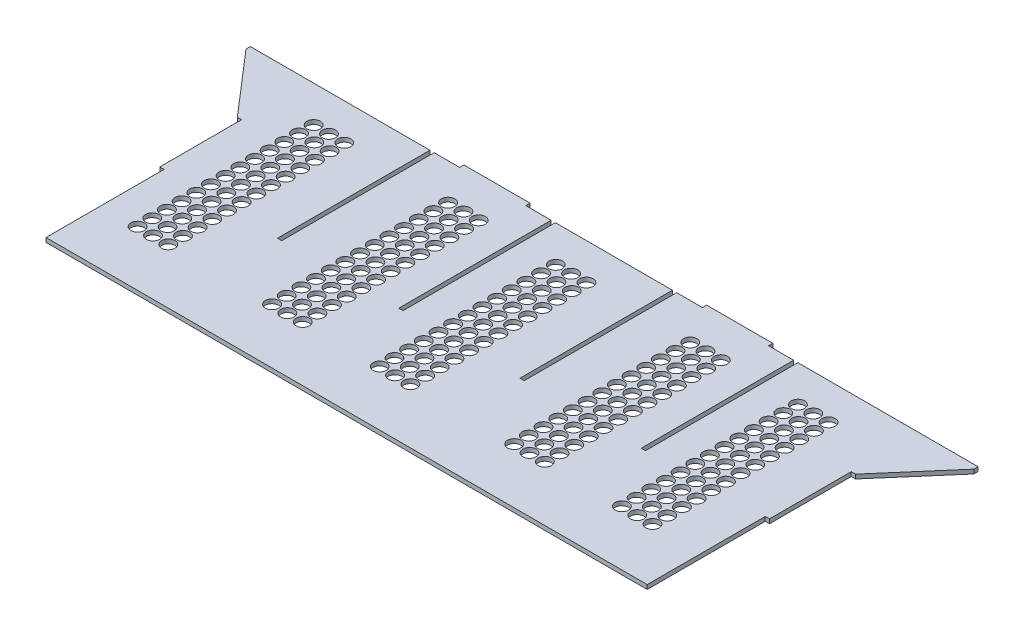
from build123d import *

# Parameters (mm, degrees)
SKETCH1_W                  = 457.2230066
SKETCH1_H                  = 3.175
BOSS_EXTRUDE1_DEPTH        = 200.6419914
SKETCH2_W                  = 3.175
SKETCH2_H                  = 114.3
CUT_EXTRUDE1_DEPTH         = 305.188278504
LPATTERN1_COUNT            = 4
LPATTERN1_PITCH            = 90.932
BOSS_EXTRUDE3_DEPTH        = 3.175
SKETCH5_W                  = 3.175
SKETCH5_H                  = 88.514
CUT_EXTRUDE2_DEPTH         = 3.175
SKETCH3_W                  = 49.658811606
SKETCH3_H                  = 3.175
BOSS_EXTRUDE4_DEPTH        = 3.18
SKETCH6_R                  = 5
CUT_EXTRUDE3_DEPTH         = 339.72456808
LPATTERN2_COUNT            = 13
LPATTERN2_PITCH            = 11
LPATTERN3_COUNT            = 3
LPATTERN3_PITCH            = 181.6
LPATTERN3_COPY_1_SKETCH_R  = 5
LPATTERN3_COPY_1_DEPTH     = 339.72456808
LPATTERN3_COPY_2_SKETCH_R  = 5
LPATTERN3_COPY_2_DEPTH     = 339.72456808
LPATTERN3_COPY_3_SKETCH_R  = 5
LPATTERN3_COPY_3_DEPTH     = 339.72456808
LPATTERN3_COPY_4_SKETCH_R  = 5
LPATTERN3_COPY_4_DEPTH     = 339.72456808
LPATTERN3_COPY_5_SKETCH_R  = 5
LPATTERN3_COPY_5_DEPTH     = 339.72456808
LPATTERN3_COPY_6_SKETCH_R  = 5
LPATTERN3_COPY_6_DEPTH     = 339.72456808
LPATTERN3_COPY_7_SKETCH_R  = 5
LPATTERN3_COPY_7_DEPTH     = 339.72456808
LPATTERN3_COPY_8_SKETCH_R  = 5
LPATTERN3_COPY_8_DEPTH     = 339.72456808
LPATTERN3_COPY_9_SKETCH_R  = 5
LPATTERN3_COPY_9_DEPTH     = 339.72456808
LPATTERN3_COPY_10_SKETCH_R = 5
LPATTERN3_COPY_10_DEPTH    = 339.72456808
LPATTERN3_COPY_11_SKETCH_R = 5
LPATTERN3_COPY_11_DEPTH    = 339.72456808
LPATTERN3_COPY_12_SKETCH_R = 5
LPATTERN3_COPY_12_DEPTH    = 339.72456808
LPATTERN3_COPY_13_SKETCH_R = 5
LPATTERN3_COPY_13_DEPTH    = 339.72456808
LPATTERN3_COPY_14_SKETCH_R = 5
LPATTERN3_COPY_14_DEPTH    = 339.72456808
LPATTERN3_COPY_15_SKETCH_R = 5
LPATTERN3_COPY_15_DEPTH    = 339.72456808
LPATTERN3_COPY_16_SKETCH_R = 5
LPATTERN3_COPY_16_DEPTH    = 339.72456808
LPATTERN3_COPY_17_SKETCH_R = 5
LPATTERN3_COPY_17_DEPTH    = 339.72456808
LPATTERN3_COPY_18_SKETCH_R = 5
LPATTERN3_COPY_18_DEPTH    = 339.72456808
LPATTERN3_COPY_19_SKETCH_R = 5
LPATTERN3_COPY_19_DEPTH    = 339.72456808
LPATTERN3_COPY_20_SKETCH_R = 5
LPATTERN3_COPY_20_DEPTH    = 339.72456808
LPATTERN3_COPY_21_SKETCH_R = 5
LPATTERN3_COPY_21_DEPTH    = 339.72456808
LPATTERN3_COPY_22_SKETCH_R = 5
LPATTERN3_COPY_22_DEPTH    = 339.72456808
LPATTERN3_COPY_23_SKETCH_R = 5
LPATTERN3_COPY_23_DEPTH    = 339.72456808
LPATTERN3_COPY_24_SKETCH_R = 5
LPATTERN3_COPY_24_DEPTH    = 339.72456808
SKETCH9_R                  = 5
CUT_EXTRUDE4_DEPTH         = 339.72456808
LPATTERN5_COUNT            = 13
LPATTERN5_PITCH            = 11
LPATTERN6_COUNT            = 2
LPATTERN6_PITCH            = 181.6
LPATTERN6_COPY_1_SKETCH_R  = 5
LPATTERN6_COPY_1_DEPTH     = 339.72456808
LPATTERN6_COPY_2_SKETCH_R  = 5
LPATTERN6_COPY_2_DEPTH     = 339.72456808
LPATTERN6_COPY_3_SKETCH_R  = 5
LPATTERN6_COPY_3_DEPTH     = 339.72456808
LPATTERN6_COPY_4_SKETCH_R  = 5
LPATTERN6_COPY_4_DEPTH     = 339.72456808
LPATTERN6_COPY_5_SKETCH_R  = 5
LPATTERN6_COPY_5_DEPTH     = 339.72456808
LPATTERN6_COPY_6_SKETCH_R  = 5
LPATTERN6_COPY_6_DEPTH     = 339.72456808
LPATTERN6_COPY_7_SKETCH_R  = 5
LPATTERN6_COPY_7_DEPTH     = 339.72456808
LPATTERN6_COPY_8_SKETCH_R  = 5
LPATTERN6_COPY_8_DEPTH     = 339.72456808
LPATTERN6_COPY_9_SKETCH_R  = 5
LPATTERN6_COPY_9_DEPTH     = 339.72456808
LPATTERN6_COPY_10_SKETCH_R = 5
LPATTERN6_COPY_10_DEPTH    = 339.72456808
LPATTERN6_COPY_11_SKETCH_R = 5
LPATTERN6_COPY_11_DEPTH    = 339.72456808
LPATTERN6_COPY_12_SKETCH_R = 5
LPATTERN6_COPY_12_DEPTH    = 339.72456808


with BuildPart() as part:
    # Sketch1 → Boss-Extrude1 (new body)
    with BuildSketch(Plane.XY):
        Rectangle(SKETCH1_W, SKETCH1_H)
    extrude(amount=BOSS_EXTRUDE1_DEPTH)

    # Sketch2 → Cut-Extrude1 (cut, through all)
    with BuildSketch(Plane(origin=(0, 1.5875, 0), x_dir=(1, 0, 0), z_dir=(0, 1, 0))):
        with Locations((136.2190033, -57.15)):
            Rectangle(SKETCH2_W, SKETCH2_H)
    cut_extrude1 = extrude(amount=-CUT_EXTRUDE1_DEPTH, mode=Mode.SUBTRACT)

    # LPattern1: Cut-Extrude1 ×4
    with Locations(*[(-i * LPATTERN1_PITCH, 0, 0) for i in range(1, LPATTERN1_COUNT)]):
        add(cut_extrude1, mode=Mode.SUBTRACT)

    # Sketch4 → Boss-Extrude3 (add)
    with BuildSketch(Plane.XZ.offset(1.5875)):
        Polygon((-228.6115033, 0), (-272.8865033, 0), (-272.8865033, 3.175), (-231.7865033, 50.8), (-228.6115033, 50.8), align=None)
    boss_extrude3 = extrude(amount=-BOSS_EXTRUDE3_DEPTH)

    # Mirror1: Boss-Extrude3 across plane
    add(boss_extrude3.mirror(Plane(origin=(0, 0, 0), x_dir=(0, 0, 1), z_dir=(1, 0, 0))))

    # Sketch5 → Cut-Extrude2 (cut)
    with BuildSketch(Plane.XZ.offset(1.5875)):
        with Locations((-227.0240033, 156.3849914)):
            Rectangle(SKETCH5_W, SKETCH5_H)
    cut_extrude2 = extrude(amount=-CUT_EXTRUDE2_DEPTH, mode=Mode.SUBTRACT)

    # Mirror2: Cut-Extrude2 across plane
    add(cut_extrude2.mirror(Plane(origin=(0, 0, 0), x_dir=(0, 0, 1), z_dir=(1, 0, 0))), mode=Mode.SUBTRACT)

    # Sketch3 → Boss-Extrude4 (add)
    with BuildSketch(Plane(origin=(0, 0, 0), x_dir=(-1, 0, 0), z_dir=(0, 0, -1))):
        with Locations((-91.020094169, 0)):
            Rectangle(SKETCH3_W, SKETCH3_H)
        with Locations((91.020094169, 0)):
            Rectangle(SKETCH3_W, SKETCH3_H)
    extrude(amount=BOSS_EXTRUDE4_DEPTH)

    # Sketch6 → Cut-Extrude3 (cut, through all)
    with BuildSketch(Plane.XZ.offset(1.5875)):
        with Locations(Location((-175.1185, 159.256662939, 0), (0, 0, 270))):
            Circle(SKETCH6_R)
        with Locations(Location((-186.6185, 159.256662939, 0), (0, 0, 270))):
            Circle(SKETCH6_R)
        with Locations(Location((-198.1185, 159.256662939, 0), (0, 0, 270))):
            Circle(SKETCH6_R)
    cut_extrude3 = extrude(amount=-CUT_EXTRUDE3_DEPTH, mode=Mode.SUBTRACT)

    # LPattern2: Cut-Extrude3 ×13
    with Locations(*[(0, 0, -i * LPATTERN2_PITCH) for i in range(1, LPATTERN2_COUNT)]):
        add(cut_extrude3, mode=Mode.SUBTRACT)

    # LPattern3: Cut-Extrude3 ×3
    with Locations(*[(i * LPATTERN3_PITCH, 0, 0) for i in range(1, LPATTERN3_COUNT)]):
        add(cut_extrude3, mode=Mode.SUBTRACT)

    # LPattern3 copy 1 sketch → LPattern3 copy 1 (cut, through all)
    with BuildSketch(Plane(origin=(181.6, -1.5875, -11), x_dir=(1, 0, 0), z_dir=(0, -1, 0))):
        with Locations(Location((-175.1185, 159.256662939, 0), (0, 0, 270))):
            Circle(LPATTERN3_COPY_1_SKETCH_R)
        with Locations(Location((-186.6185, 159.256662939, 0), (0, 0, 270))):
            Circle(LPATTERN3_COPY_1_SKETCH_R)
        with Locations(Location((-198.1185, 159.256662939, 0), (0, 0, 270))):
            Circle(LPATTERN3_COPY_1_SKETCH_R)
    extrude(amount=-LPATTERN3_COPY_1_DEPTH, mode=Mode.SUBTRACT)

    # LPattern3 copy 2 sketch → LPattern3 copy 2 (cut, through all)
    with BuildSketch(Plane(origin=(363.2, -1.5875, -11), x_dir=(1, 0, 0), z_dir=(0, -1, 0))):
        with Locations(Location((-175.1185, 159.256662939, 0), (0, 0, 270))):
            Circle(LPATTERN3_COPY_2_SKETCH_R)
        with Locations(Location((-186.6185, 159.256662939, 0), (0, 0, 270))):
            Circle(LPATTERN3_COPY_2_SKETCH_R)
        with Locations(Location((-198.1185, 159.256662939, 0), (0, 0, 270))):
            Circle(LPATTERN3_COPY_2_SKETCH_R)
    extrude(amount=-LPATTERN3_COPY_2_DEPTH, mode=Mode.SUBTRACT)

    # LPattern3 copy 3 sketch → LPattern3 copy 3 (cut, through all)
    with BuildSketch(Plane(origin=(181.6, -1.5875, -22), x_dir=(1, 0, 0), z_dir=(0, -1, 0))):
        with Locations(Location((-175.1185, 159.256662939, 0), (0, 0, 270))):
            Circle(LPATTERN3_COPY_3_SKETCH_R)
        with Locations(Location((-186.6185, 159.256662939, 0), (0, 0, 270))):
            Circle(LPATTERN3_COPY_3_SKETCH_R)
        with Locations(Location((-198.1185, 159.256662939, 0), (0, 0, 270))):
            Circle(LPATTERN3_COPY_3_SKETCH_R)
    extrude(amount=-LPATTERN3_COPY_3_DEPTH, mode=Mode.SUBTRACT)

    # LPattern3 copy 4 sketch → LPattern3 copy 4 (cut, through all)
    with BuildSketch(Plane(origin=(363.2, -1.5875, -22), x_dir=(1, 0, 0), z_dir=(0, -1, 0))):
        with Locations(Location((-175.1185, 159.256662939, 0), (0, 0, 270))):
            Circle(LPATTERN3_COPY_4_SKETCH_R)
        with Locations(Location((-186.6185, 159.256662939, 0), (0, 0, 270))):
            Circle(LPATTERN3_COPY_4_SKETCH_R)
        with Locations(Location((-198.1185, 159.256662939, 0), (0, 0, 270))):
            Circle(LPATTERN3_COPY_4_SKETCH_R)
    extrude(amount=-LPATTERN3_COPY_4_DEPTH, mode=Mode.SUBTRACT)

    # LPattern3 copy 5 sketch → LPattern3 copy 5 (cut, through all)
    with BuildSketch(Plane(origin=(181.6, -1.5875, -33), x_dir=(1, 0, 0), z_dir=(0, -1, 0))):
        with Locations(Location((-175.1185, 159.256662939, 0), (0, 0, 270))):
            Circle(LPATTERN3_COPY_5_SKETCH_R)
        with Locations(Location((-186.6185, 159.256662939, 0), (0, 0, 270))):
            Circle(LPATTERN3_COPY_5_SKETCH_R)
        with Locations(Location((-198.1185, 159.256662939, 0), (0, 0, 270))):
            Circle(LPATTERN3_COPY_5_SKETCH_R)
    extrude(amount=-LPATTERN3_COPY_5_DEPTH, mode=Mode.SUBTRACT)

    # LPattern3 copy 6 sketch → LPattern3 copy 6 (cut, through all)
    with BuildSketch(Plane(origin=(363.2, -1.5875, -33), x_dir=(1, 0, 0), z_dir=(0, -1, 0))):
        with Locations(Location((-175.1185, 159.256662939, 0), (0, 0, 270))):
            Circle(LPATTERN3_COPY_6_SKETCH_R)
        with Locations(Location((-186.6185, 159.256662939, 0), (0, 0, 270))):
            Circle(LPATTERN3_COPY_6_SKETCH_R)
        with Locations(Location((-198.1185, 159.256662939, 0), (0, 0, 270))):
            Circle(LPATTERN3_COPY_6_SKETCH_R)
    extrude(amount=-LPATTERN3_COPY_6_DEPTH, mode=Mode.SUBTRACT)

    # LPattern3 copy 7 sketch → LPattern3 copy 7 (cut, through all)
    with BuildSketch(Plane(origin=(181.6, -1.5875, -44), x_dir=(1, 0, 0), z_dir=(0, -1, 0))):
        with Locations(Location((-175.1185, 159.256662939, 0), (0, 0, 270))):
            Circle(LPATTERN3_COPY_7_SKETCH_R)
        with Locations(Location((-186.6185, 159.256662939, 0), (0, 0, 270))):
            Circle(LPATTERN3_COPY_7_SKETCH_R)
        with Locations(Location((-198.1185, 159.256662939, 0), (0, 0, 270))):
            Circle(LPATTERN3_COPY_7_SKETCH_R)
    extrude(amount=-LPATTERN3_COPY_7_DEPTH, mode=Mode.SUBTRACT)

    # LPattern3 copy 8 sketch → LPattern3 copy 8 (cut, through all)
    with BuildSketch(Plane(origin=(363.2, -1.5875, -44), x_dir=(1, 0, 0), z_dir=(0, -1, 0))):
        with Locations(Location((-175.1185, 159.256662939, 0), (0, 0, 270))):
            Circle(LPATTERN3_COPY_8_SKETCH_R)
        with Locations(Location((-186.6185, 159.256662939, 0), (0, 0, 270))):
            Circle(LPATTERN3_COPY_8_SKETCH_R)
        with Locations(Location((-198.1185, 159.256662939, 0), (0, 0, 270))):
            Circle(LPATTERN3_COPY_8_SKETCH_R)
    extrude(amount=-LPATTERN3_COPY_8_DEPTH, mode=Mode.SUBTRACT)

    # LPattern3 copy 9 sketch → LPattern3 copy 9 (cut, through all)
    with BuildSketch(Plane(origin=(181.6, -1.5875, -55), x_dir=(1, 0, 0), z_dir=(0, -1, 0))):
        with Locations(Location((-175.1185, 159.256662939, 0), (0, 0, 270))):
            Circle(LPATTERN3_COPY_9_SKETCH_R)
        with Locations(Location((-186.6185, 159.256662939, 0), (0, 0, 270))):
            Circle(LPATTERN3_COPY_9_SKETCH_R)
        with Locations(Location((-198.1185, 159.256662939, 0), (0, 0, 270))):
            Circle(LPATTERN3_COPY_9_SKETCH_R)
    extrude(amount=-LPATTERN3_COPY_9_DEPTH, mode=Mode.SUBTRACT)

    # LPattern3 copy 10 sketch → LPattern3 copy 10 (cut, through all)
    with BuildSketch(Plane(origin=(363.2, -1.5875, -55), x_dir=(1, 0, 0), z_dir=(0, -1, 0))):
        with Locations(Location((-175.1185, 159.256662939, 0), (0, 0, 270))):
            Circle(LPATTERN3_COPY_10_SKETCH_R)
        with Locations(Location((-186.6185, 159.256662939, 0), (0, 0, 270))):
            Circle(LPATTERN3_COPY_10_SKETCH_R)
        with Locations(Location((-198.1185, 159.256662939, 0), (0, 0, 270))):
            Circle(LPATTERN3_COPY_10_SKETCH_R)
    extrude(amount=-LPATTERN3_COPY_10_DEPTH, mode=Mode.SUBTRACT)

    # LPattern3 copy 11 sketch → LPattern3 copy 11 (cut, through all)
    with BuildSketch(Plane(origin=(181.6, -1.5875, -66), x_dir=(1, 0, 0), z_dir=(0, -1, 0))):
        with Locations(Location((-175.1185, 159.256662939, 0), (0, 0, 270))):
            Circle(LPATTERN3_COPY_11_SKETCH_R)
        with Locations(Location((-186.6185, 159.256662939, 0), (0, 0, 270))):
            Circle(LPATTERN3_COPY_11_SKETCH_R)
        with Locations(Location((-198.1185, 159.256662939, 0), (0, 0, 270))):
            Circle(LPATTERN3_COPY_11_SKETCH_R)
    extrude(amount=-LPATTERN3_COPY_11_DEPTH, mode=Mode.SUBTRACT)

    # LPattern3 copy 12 sketch → LPattern3 copy 12 (cut, through all)
    with BuildSketch(Plane(origin=(363.2, -1.5875, -66), x_dir=(1, 0, 0), z_dir=(0, -1, 0))):
        with Locations(Location((-175.1185, 159.256662939, 0), (0, 0, 270))):
            Circle(LPATTERN3_COPY_12_SKETCH_R)
        with Locations(Location((-186.6185, 159.256662939, 0), (0, 0, 270))):
            Circle(LPATTERN3_COPY_12_SKETCH_R)
        with Locations(Location((-198.1185, 159.256662939, 0), (0, 0, 270))):
            Circle(LPATTERN3_COPY_12_SKETCH_R)
    extrude(amount=-LPATTERN3_COPY_12_DEPTH, mode=Mode.SUBTRACT)

    # LPattern3 copy 13 sketch → LPattern3 copy 13 (cut, through all)
    with BuildSketch(Plane(origin=(181.6, -1.5875, -77), x_dir=(1, 0, 0), z_dir=(0, -1, 0))):
        with Locations(Location((-175.1185, 159.256662939, 0), (0, 0, 270))):
            Circle(LPATTERN3_COPY_13_SKETCH_R)
        with Locations(Location((-186.6185, 159.256662939, 0), (0, 0, 270))):
            Circle(LPATTERN3_COPY_13_SKETCH_R)
        with Locations(Location((-198.1185, 159.256662939, 0), (0, 0, 270))):
            Circle(LPATTERN3_COPY_13_SKETCH_R)
    extrude(amount=-LPATTERN3_COPY_13_DEPTH, mode=Mode.SUBTRACT)

    # LPattern3 copy 14 sketch → LPattern3 copy 14 (cut, through all)
    with BuildSketch(Plane(origin=(363.2, -1.5875, -77), x_dir=(1, 0, 0), z_dir=(0, -1, 0))):
        with Locations(Location((-175.1185, 159.256662939, 0), (0, 0, 270))):
            Circle(LPATTERN3_COPY_14_SKETCH_R)
        with Locations(Location((-186.6185, 159.256662939, 0), (0, 0, 270))):
            Circle(LPATTERN3_COPY_14_SKETCH_R)
        with Locations(Location((-198.1185, 159.256662939, 0), (0, 0, 270))):
            Circle(LPATTERN3_COPY_14_SKETCH_R)
    extrude(amount=-LPATTERN3_COPY_14_DEPTH, mode=Mode.SUBTRACT)

    # LPattern3 copy 15 sketch → LPattern3 copy 15 (cut, through all)
    with BuildSketch(Plane(origin=(181.6, -1.5875, -88), x_dir=(1, 0, 0), z_dir=(0, -1, 0))):
        with Locations(Location((-175.1185, 159.256662939, 0), (0, 0, 270))):
            Circle(LPATTERN3_COPY_15_SKETCH_R)
        with Locations(Location((-186.6185, 159.256662939, 0), (0, 0, 270))):
            Circle(LPATTERN3_COPY_15_SKETCH_R)
        with Locations(Location((-198.1185, 159.256662939, 0), (0, 0, 270))):
            Circle(LPATTERN3_COPY_15_SKETCH_R)
    extrude(amount=-LPATTERN3_COPY_15_DEPTH, mode=Mode.SUBTRACT)

    # LPattern3 copy 16 sketch → LPattern3 copy 16 (cut, through all)
    with BuildSketch(Plane(origin=(363.2, -1.5875, -88), x_dir=(1, 0, 0), z_dir=(0, -1, 0))):
        with Locations(Location((-175.1185, 159.256662939, 0), (0, 0, 270))):
            Circle(LPATTERN3_COPY_16_SKETCH_R)
        with Locations(Location((-186.6185, 159.256662939, 0), (0, 0, 270))):
            Circle(LPATTERN3_COPY_16_SKETCH_R)
        with Locations(Location((-198.1185, 159.256662939, 0), (0, 0, 270))):
            Circle(LPATTERN3_COPY_16_SKETCH_R)
    extrude(amount=-LPATTERN3_COPY_16_DEPTH, mode=Mode.SUBTRACT)

    # LPattern3 copy 17 sketch → LPattern3 copy 17 (cut, through all)
    with BuildSketch(Plane(origin=(181.6, -1.5875, -99), x_dir=(1, 0, 0), z_dir=(0, -1, 0))):
        with Locations(Location((-175.1185, 159.256662939, 0), (0, 0, 270))):
            Circle(LPATTERN3_COPY_17_SKETCH_R)
        with Locations(Location((-186.6185, 159.256662939, 0), (0, 0, 270))):
            Circle(LPATTERN3_COPY_17_SKETCH_R)
        with Locations(Location((-198.1185, 159.256662939, 0), (0, 0, 270))):
            Circle(LPATTERN3_COPY_17_SKETCH_R)
    extrude(amount=-LPATTERN3_COPY_17_DEPTH, mode=Mode.SUBTRACT)

    # LPattern3 copy 18 sketch → LPattern3 copy 18 (cut, through all)
    with BuildSketch(Plane(origin=(363.2, -1.5875, -99), x_dir=(1, 0, 0), z_dir=(0, -1, 0))):
        with Locations(Location((-175.1185, 159.256662939, 0), (0, 0, 270))):
            Circle(LPATTERN3_COPY_18_SKETCH_R)
        with Locations(Location((-186.6185, 159.256662939, 0), (0, 0, 270))):
            Circle(LPATTERN3_COPY_18_SKETCH_R)
        with Locations(Location((-198.1185, 159.256662939, 0), (0, 0, 270))):
            Circle(LPATTERN3_COPY_18_SKETCH_R)
    extrude(amount=-LPATTERN3_COPY_18_DEPTH, mode=Mode.SUBTRACT)

    # LPattern3 copy 19 sketch → LPattern3 copy 19 (cut, through all)
    with BuildSketch(Plane(origin=(181.6, -1.5875, -110), x_dir=(1, 0, 0), z_dir=(0, -1, 0))):
        with Locations(Location((-175.1185, 159.256662939, 0), (0, 0, 270))):
            Circle(LPATTERN3_COPY_19_SKETCH_R)
        with Locations(Location((-186.6185, 159.256662939, 0), (0, 0, 270))):
            Circle(LPATTERN3_COPY_19_SKETCH_R)
        with Locations(Location((-198.1185, 159.256662939, 0), (0, 0, 270))):
            Circle(LPATTERN3_COPY_19_SKETCH_R)
    extrude(amount=-LPATTERN3_COPY_19_DEPTH, mode=Mode.SUBTRACT)

    # LPattern3 copy 20 sketch → LPattern3 copy 20 (cut, through all)
    with BuildSketch(Plane(origin=(363.2, -1.5875, -110), x_dir=(1, 0, 0), z_dir=(0, -1, 0))):
        with Locations(Location((-175.1185, 159.256662939, 0), (0, 0, 270))):
            Circle(LPATTERN3_COPY_20_SKETCH_R)
        with Locations(Location((-186.6185, 159.256662939, 0), (0, 0, 270))):
            Circle(LPATTERN3_COPY_20_SKETCH_R)
        with Locations(Location((-198.1185, 159.256662939, 0), (0, 0, 270))):
            Circle(LPATTERN3_COPY_20_SKETCH_R)
    extrude(amount=-LPATTERN3_COPY_20_DEPTH, mode=Mode.SUBTRACT)

    # LPattern3 copy 21 sketch → LPattern3 copy 21 (cut, through all)
    with BuildSketch(Plane(origin=(181.6, -1.5875, -121), x_dir=(1, 0, 0), z_dir=(0, -1, 0))):
        with Locations(Location((-175.1185, 159.256662939, 0), (0, 0, 270))):
            Circle(LPATTERN3_COPY_21_SKETCH_R)
        with Locations(Location((-186.6185, 159.256662939, 0), (0, 0, 270))):
            Circle(LPATTERN3_COPY_21_SKETCH_R)
        with Locations(Location((-198.1185, 159.256662939, 0), (0, 0, 270))):
            Circle(LPATTERN3_COPY_21_SKETCH_R)
    extrude(amount=-LPATTERN3_COPY_21_DEPTH, mode=Mode.SUBTRACT)

    # LPattern3 copy 22 sketch → LPattern3 copy 22 (cut, through all)
    with BuildSketch(Plane(origin=(363.2, -1.5875, -121), x_dir=(1, 0, 0), z_dir=(0, -1, 0))):
        with Locations(Location((-175.1185, 159.256662939, 0), (0, 0, 270))):
            Circle(LPATTERN3_COPY_22_SKETCH_R)
        with Locations(Location((-186.6185, 159.256662939, 0), (0, 0, 270))):
            Circle(LPATTERN3_COPY_22_SKETCH_R)
        with Locations(Location((-198.1185, 159.256662939, 0), (0, 0, 270))):
            Circle(LPATTERN3_COPY_22_SKETCH_R)
    extrude(amount=-LPATTERN3_COPY_22_DEPTH, mode=Mode.SUBTRACT)

    # LPattern3 copy 23 sketch → LPattern3 copy 23 (cut, through all)
    with BuildSketch(Plane(origin=(181.6, -1.5875, -132), x_dir=(1, 0, 0), z_dir=(0, -1, 0))):
        with Locations(Location((-175.1185, 159.256662939, 0), (0, 0, 270))):
            Circle(LPATTERN3_COPY_23_SKETCH_R)
        with Locations(Location((-186.6185, 159.256662939, 0), (0, 0, 270))):
            Circle(LPATTERN3_COPY_23_SKETCH_R)
        with Locations(Location((-198.1185, 159.256662939, 0), (0, 0, 270))):
            Circle(LPATTERN3_COPY_23_SKETCH_R)
    extrude(amount=-LPATTERN3_COPY_23_DEPTH, mode=Mode.SUBTRACT)

    # LPattern3 copy 24 sketch → LPattern3 copy 24 (cut, through all)
    with BuildSketch(Plane(origin=(363.2, -1.5875, -132), x_dir=(1, 0, 0), z_dir=(0, -1, 0))):
        with Locations(Location((-175.1185, 159.256662939, 0), (0, 0, 270))):
            Circle(LPATTERN3_COPY_24_SKETCH_R)
        with Locations(Location((-186.6185, 159.256662939, 0), (0, 0, 270))):
            Circle(LPATTERN3_COPY_24_SKETCH_R)
        with Locations(Location((-198.1185, 159.256662939, 0), (0, 0, 270))):
            Circle(LPATTERN3_COPY_24_SKETCH_R)
    extrude(amount=-LPATTERN3_COPY_24_DEPTH, mode=Mode.SUBTRACT)

    # Sketch9 → Cut-Extrude4 (cut, through all)
    with BuildSketch(Plane.XZ.offset(1.5875)):
        with Locations(Location((-74.3095, 159.256662939, 0), (0, 0, 270))):
            Circle(SKETCH9_R)
        with Locations(Location((-85.8095, 159.256662939, 0), (0, 0, 270))):
            Circle(SKETCH9_R)
        with Locations(Location((-97.3095, 159.256662939, 0), (0, 0, 270))):
            Circle(SKETCH9_R)
    cut_extrude4 = extrude(amount=-CUT_EXTRUDE4_DEPTH, mode=Mode.SUBTRACT)

    # LPattern5: Cut-Extrude4 ×13
    with Locations(*[(0, 0, -i * LPATTERN5_PITCH) for i in range(1, LPATTERN5_COUNT)]):
        add(cut_extrude4, mode=Mode.SUBTRACT)

    # LPattern6: Cut-Extrude4 ×2
    with Locations(*[(i * LPATTERN6_PITCH, 0, 0) for i in range(1, LPATTERN6_COUNT)]):
        add(cut_extrude4, mode=Mode.SUBTRACT)

    # LPattern6 copy 1 sketch → LPattern6 copy 1 (cut, through all)
    with BuildSketch(Plane(origin=(181.6, -1.5875, -11), x_dir=(1, 0, 0), z_dir=(0, -1, 0))):
        with Locations(Location((-74.3095, 159.256662939, 0), (0, 0, 270))):
            Circle(LPATTERN6_COPY_1_SKETCH_R)
        with Locations(Location((-85.8095, 159.256662939, 0), (0, 0, 270))):
            Circle(LPATTERN6_COPY_1_SKETCH_R)
        with Locations(Location((-97.3095, 159.256662939, 0), (0, 0, 270))):
            Circle(LPATTERN6_COPY_1_SKETCH_R)
    extrude(amount=-LPATTERN6_COPY_1_DEPTH, mode=Mode.SUBTRACT)

    # LPattern6 copy 2 sketch → LPattern6 copy 2 (cut, through all)
    with BuildSketch(Plane(origin=(181.6, -1.5875, -22), x_dir=(1, 0, 0), z_dir=(0, -1, 0))):
        with Locations(Location((-74.3095, 159.256662939, 0), (0, 0, 270))):
            Circle(LPATTERN6_COPY_2_SKETCH_R)
        with Locations(Location((-85.8095, 159.256662939, 0), (0, 0, 270))):
            Circle(LPATTERN6_COPY_2_SKETCH_R)
        with Locations(Location((-97.3095, 159.256662939, 0), (0, 0, 270))):
            Circle(LPATTERN6_COPY_2_SKETCH_R)
    extrude(amount=-LPATTERN6_COPY_2_DEPTH, mode=Mode.SUBTRACT)

    # LPattern6 copy 3 sketch → LPattern6 copy 3 (cut, through all)
    with BuildSketch(Plane(origin=(181.6, -1.5875, -33), x_dir=(1, 0, 0), z_dir=(0, -1, 0))):
        with Locations(Location((-74.3095, 159.256662939, 0), (0, 0, 270))):
            Circle(LPATTERN6_COPY_3_SKETCH_R)
        with Locations(Location((-85.8095, 159.256662939, 0), (0, 0, 270))):
            Circle(LPATTERN6_COPY_3_SKETCH_R)
        with Locations(Location((-97.3095, 159.256662939, 0), (0, 0, 270))):
            Circle(LPATTERN6_COPY_3_SKETCH_R)
    extrude(amount=-LPATTERN6_COPY_3_DEPTH, mode=Mode.SUBTRACT)

    # LPattern6 copy 4 sketch → LPattern6 copy 4 (cut, through all)
    with BuildSketch(Plane(origin=(181.6, -1.5875, -44), x_dir=(1, 0, 0), z_dir=(0, -1, 0))):
        with Locations(Location((-74.3095, 159.256662939, 0), (0, 0, 270))):
            Circle(LPATTERN6_COPY_4_SKETCH_R)
        with Locations(Location((-85.8095, 159.256662939, 0), (0, 0, 270))):
            Circle(LPATTERN6_COPY_4_SKETCH_R)
        with Locations(Location((-97.3095, 159.256662939, 0), (0, 0, 270))):
            Circle(LPATTERN6_COPY_4_SKETCH_R)
    extrude(amount=-LPATTERN6_COPY_4_DEPTH, mode=Mode.SUBTRACT)

    # LPattern6 copy 5 sketch → LPattern6 copy 5 (cut, through all)
    with BuildSketch(Plane(origin=(181.6, -1.5875, -55), x_dir=(1, 0, 0), z_dir=(0, -1, 0))):
        with Locations(Location((-74.3095, 159.256662939, 0), (0, 0, 270))):
            Circle(LPATTERN6_COPY_5_SKETCH_R)
        with Locations(Location((-85.8095, 159.256662939, 0), (0, 0, 270))):
            Circle(LPATTERN6_COPY_5_SKETCH_R)
        with Locations(Location((-97.3095, 159.256662939, 0), (0, 0, 270))):
            Circle(LPATTERN6_COPY_5_SKETCH_R)
    extrude(amount=-LPATTERN6_COPY_5_DEPTH, mode=Mode.SUBTRACT)

    # LPattern6 copy 6 sketch → LPattern6 copy 6 (cut, through all)
    with BuildSketch(Plane(origin=(181.6, -1.5875, -66), x_dir=(1, 0, 0), z_dir=(0, -1, 0))):
        with Locations(Location((-74.3095, 159.256662939, 0), (0, 0, 270))):
            Circle(LPATTERN6_COPY_6_SKETCH_R)
        with Locations(Location((-85.8095, 159.256662939, 0), (0, 0, 270))):
            Circle(LPATTERN6_COPY_6_SKETCH_R)
        with Locations(Location((-97.3095, 159.256662939, 0), (0, 0, 270))):
            Circle(LPATTERN6_COPY_6_SKETCH_R)
    extrude(amount=-LPATTERN6_COPY_6_DEPTH, mode=Mode.SUBTRACT)

    # LPattern6 copy 7 sketch → LPattern6 copy 7 (cut, through all)
    with BuildSketch(Plane(origin=(181.6, -1.5875, -77), x_dir=(1, 0, 0), z_dir=(0, -1, 0))):
        with Locations(Location((-74.3095, 159.256662939, 0), (0, 0, 270))):
            Circle(LPATTERN6_COPY_7_SKETCH_R)
        with Locations(Location((-85.8095, 159.256662939, 0), (0, 0, 270))):
            Circle(LPATTERN6_COPY_7_SKETCH_R)
        with Locations(Location((-97.3095, 159.256662939, 0), (0, 0, 270))):
            Circle(LPATTERN6_COPY_7_SKETCH_R)
    extrude(amount=-LPATTERN6_COPY_7_DEPTH, mode=Mode.SUBTRACT)

    # LPattern6 copy 8 sketch → LPattern6 copy 8 (cut, through all)
    with BuildSketch(Plane(origin=(181.6, -1.5875, -88), x_dir=(1, 0, 0), z_dir=(0, -1, 0))):
        with Locations(Location((-74.3095, 159.256662939, 0), (0, 0, 270))):
            Circle(LPATTERN6_COPY_8_SKETCH_R)
        with Locations(Location((-85.8095, 159.256662939, 0), (0, 0, 270))):
            Circle(LPATTERN6_COPY_8_SKETCH_R)
        with Locations(Location((-97.3095, 159.256662939, 0), (0, 0, 270))):
            Circle(LPATTERN6_COPY_8_SKETCH_R)
    extrude(amount=-LPATTERN6_COPY_8_DEPTH, mode=Mode.SUBTRACT)

    # LPattern6 copy 9 sketch → LPattern6 copy 9 (cut, through all)
    with BuildSketch(Plane(origin=(181.6, -1.5875, -99), x_dir=(1, 0, 0), z_dir=(0, -1, 0))):
        with Locations(Location((-74.3095, 159.256662939, 0), (0, 0, 270))):
            Circle(LPATTERN6_COPY_9_SKETCH_R)
        with Locations(Location((-85.8095, 159.256662939, 0), (0, 0, 270))):
            Circle(LPATTERN6_COPY_9_SKETCH_R)
        with Locations(Location((-97.3095, 159.256662939, 0), (0, 0, 270))):
            Circle(LPATTERN6_COPY_9_SKETCH_R)
    extrude(amount=-LPATTERN6_COPY_9_DEPTH, mode=Mode.SUBTRACT)

    # LPattern6 copy 10 sketch → LPattern6 copy 10 (cut, through all)
    with BuildSketch(Plane(origin=(181.6, -1.5875, -110), x_dir=(1, 0, 0), z_dir=(0, -1, 0))):
        with Locations(Location((-74.3095, 159.256662939, 0), (0, 0, 270))):
            Circle(LPATTERN6_COPY_10_SKETCH_R)
        with Locations(Location((-85.8095, 159.256662939, 0), (0, 0, 270))):
            Circle(LPATTERN6_COPY_10_SKETCH_R)
        with Locations(Location((-97.3095, 159.256662939, 0), (0, 0, 270))):
            Circle(LPATTERN6_COPY_10_SKETCH_R)
    extrude(amount=-LPATTERN6_COPY_10_DEPTH, mode=Mode.SUBTRACT)

    # LPattern6 copy 11 sketch → LPattern6 copy 11 (cut, through all)
    with BuildSketch(Plane(origin=(181.6, -1.5875, -121), x_dir=(1, 0, 0), z_dir=(0, -1, 0))):
        with Locations(Location((-74.3095, 159.256662939, 0), (0, 0, 270))):
            Circle(LPATTERN6_COPY_11_SKETCH_R)
        with Locations(Location((-85.8095, 159.256662939, 0), (0, 0, 270))):
            Circle(LPATTERN6_COPY_11_SKETCH_R)
        with Locations(Location((-97.3095, 159.256662939, 0), (0, 0, 270))):
            Circle(LPATTERN6_COPY_11_SKETCH_R)
    extrude(amount=-LPATTERN6_COPY_11_DEPTH, mode=Mode.SUBTRACT)

    # LPattern6 copy 12 sketch → LPattern6 copy 12 (cut, through all)
    with BuildSketch(Plane(origin=(181.6, -1.5875, -132), x_dir=(1, 0, 0), z_dir=(0, -1, 0))):
        with Locations(Location((-74.3095, 159.256662939, 0), (0, 0, 270))):
            Circle(LPATTERN6_COPY_12_SKETCH_R)
        with Locations(Location((-85.8095, 159.256662939, 0), (0, 0, 270))):
            Circle(LPATTERN6_COPY_12_SKETCH_R)
        with Locations(Location((-97.3095, 159.256662939, 0), (0, 0, 270))):
            Circle(LPATTERN6_COPY_12_SKETCH_R)
    extrude(amount=-LPATTERN6_COPY_12_DEPTH, mode=Mode.SUBTRACT)


solid = part.part
